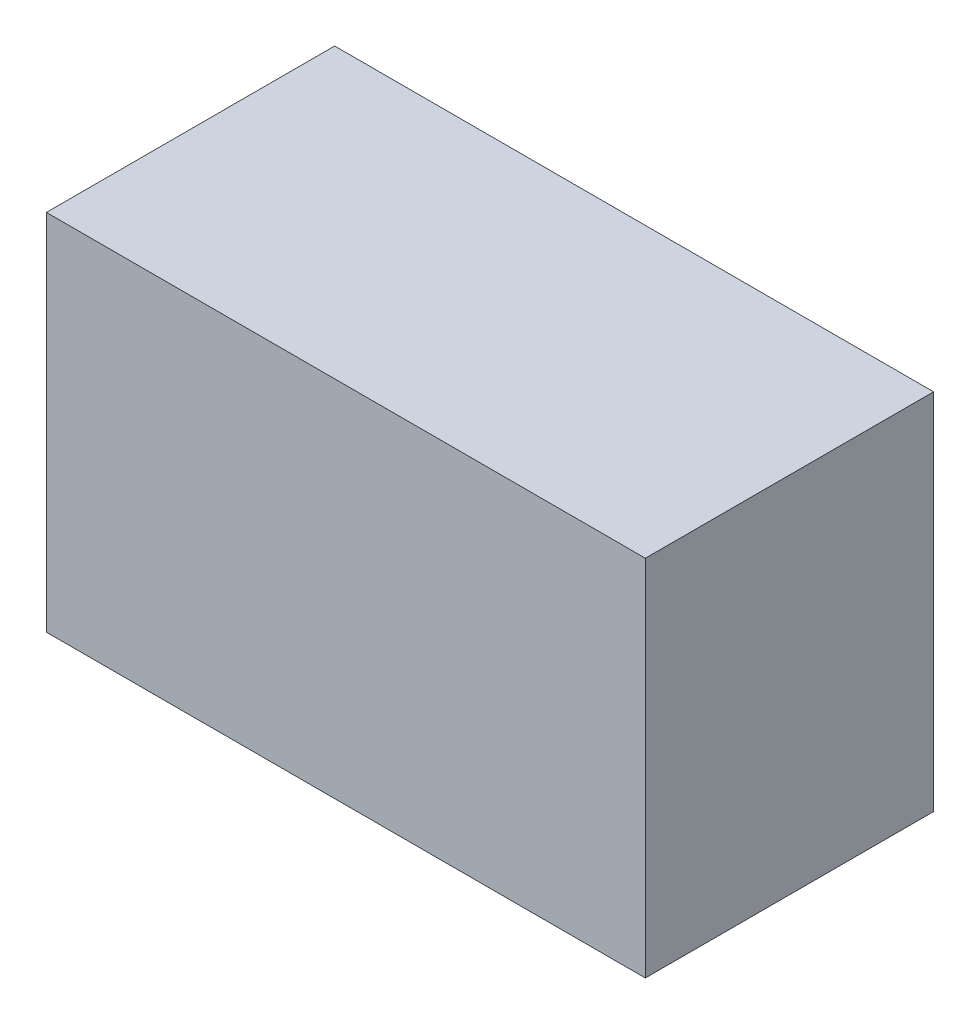
from build123d import *

# Parameters (mm, degrees)
SKETCH1_R           = 13.044310864
BOSS_EXTRUDE1_DEPTH = 2
SKETCH2_W           = 41.559490096
SKETCH2_H           = 25.224294724
BOSS_EXTRUDE2_DEPTH = 10


with BuildPart() as part:
    # Sketch1 → Boss-Extrude1 (new body)
    with BuildSketch(Plane.XY):
        with Locations((0.057673109, -0.629813302)):
            Circle(SKETCH1_R)
    extrude(amount=BOSS_EXTRUDE1_DEPTH)


with BuildPart() as body_2:
    # Sketch2 → Boss-Extrude2 (new, symmetric)
    with BuildSketch(Plane.XY.offset(2)):
        Rectangle(SKETCH2_W, SKETCH2_H)
    extrude(amount=BOSS_EXTRUDE2_DEPTH, both=True)


solid = Compound([part.part, body_2.part])
